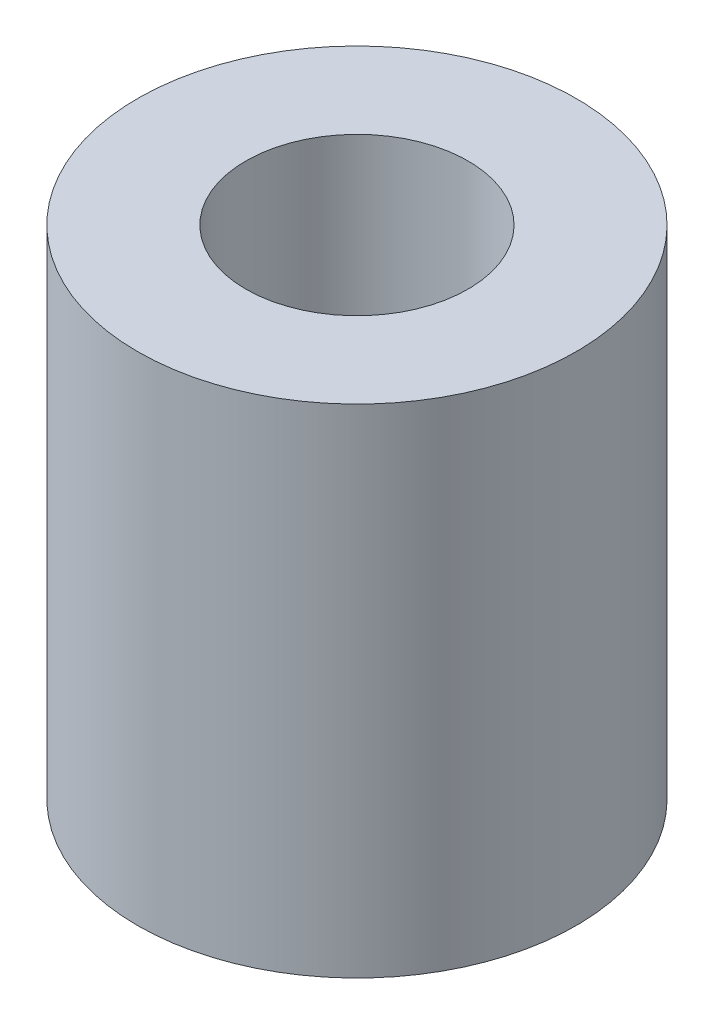
from build123d import *

# Parameters (mm, degrees)
SKETCH1_R           = 9.525
SKETCH1_R_2         = 4.826
BOSS_EXTRUDE1_DEPTH = 21.59


with BuildPart() as part:
    # Sketch1 → Boss-Extrude1 (new body)
    with BuildSketch(Plane(origin=(0, 0, 0), x_dir=(1, 0, 0), z_dir=(0, 1, 0))):
        with Locations(Location((0, 0, 0), (0, 0, 270))):
            Circle(SKETCH1_R)
        with Locations(Location((0, 0, 0), (0, 0, 270))):
            Circle(SKETCH1_R_2, mode=Mode.SUBTRACT)
    extrude(amount=BOSS_EXTRUDE1_DEPTH)


solid = part.part
